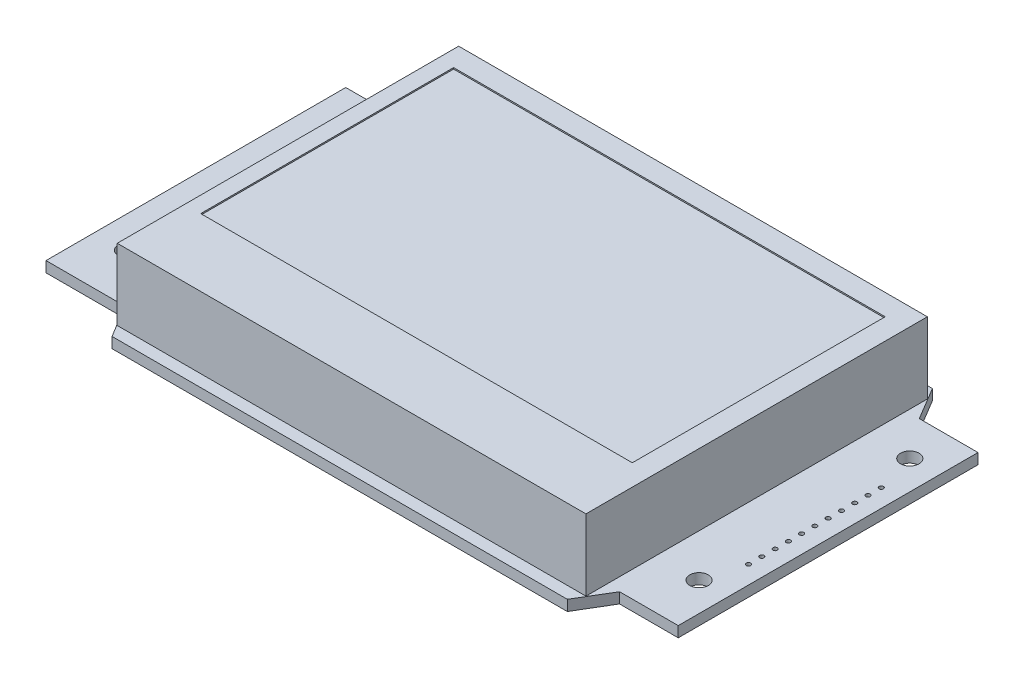
from build123d import *

# Parameters (mm, degrees)
BOSS_EXTRUDE1_DEPTH = 1.6
SKETCH2_R           = 1.397
CUT_EXTRUDE1_DEPTH  = 67.676798076
SKETCH3_W           = 70.612
SKETCH3_H           = 51.435
BOSS_EXTRUDE2_DEPTH = 10.7315
SKETCH4_W           = 65.024
SKETCH4_H           = 38.1
CUT_EXTRUDE2_DEPTH  = 0.2
SKETCH5_R           = 0.3302
CUT_EXTRUDE3_DEPTH  = 68.515927705
LPATTERN1_COUNT     = 11
LPATTERN1_PITCH     = 2


with BuildPart() as part:
    # Sketch1 → Boss-Extrude1 (new body)
    with BuildSketch(Plane(origin=(0, 0, 0), x_dir=(1, 0, 0), z_dir=(0, 1, 0))):
        Polygon((-60.059561589, 21.169974834), (-60.059561589, -23.991225166), (-48.223161589, -23.991225166), (-45.175161589, -28.915125166), (23.404838411, -28.915125166), (26.351238411, -23.991225166), (35.190438411, -23.991225166), (35.190438411, 21.169974834), (26.351238411, 21.169974834), (23.404838411, 26.084874834), (-45.175161589, 26.084874834), (-48.223161589, 21.169974834), align=None)
    extrude(amount=BOSS_EXTRUDE1_DEPTH)

    # Sketch2 → Cut-Extrude1 (cut, through all)
    with BuildSketch(Plane(origin=(0, 1.6, 0), x_dir=(1, 0, 0), z_dir=(0, 1, 0))):
        with Locations(Location((-55.271661589, 15.251774834, 0), (0, 0, 270))):
            Circle(SKETCH2_R)
        with Locations(Location((-55.271661589, -16.498225166, 0), (0, 0, 270))):
            Circle(SKETCH2_R)
        with Locations(Location((30.834338411, -16.498225166, 0), (0, 0, 270))):
            Circle(SKETCH2_R)
        with Locations(Location((30.834338411, 15.251774834, 0), (0, 0, 270))):
            Circle(SKETCH2_R)
    extrude(amount=-CUT_EXTRUDE1_DEPTH, mode=Mode.SUBTRACT)

    # Sketch3 → Boss-Extrude2 (add)
    with BuildSketch(Plane(origin=(0, 1.6, 0), x_dir=(1, 0, 0), z_dir=(0, 1, 0))):
        with Locations((-10.910561589, -1.382625166)):
            Rectangle(SKETCH3_W, SKETCH3_H)
    extrude(amount=BOSS_EXTRUDE2_DEPTH)

    # Sketch4 → Cut-Extrude2 (cut)
    with BuildSketch(Plane(origin=(0, 12.3315, 0), x_dir=(1, 0, 0), z_dir=(0, 1, 0))):
        with Locations((-11.291561589, 2.109874834)):
            Rectangle(SKETCH4_W, SKETCH4_H)
    extrude(amount=-CUT_EXTRUDE2_DEPTH, mode=Mode.SUBTRACT)

    # Sketch5 → Cut-Extrude3 (cut, through all)
    with BuildSketch(Plane(origin=(0, 1.6, 0), x_dir=(1, 0, 0), z_dir=(0, 1, 0))):
        with Locations(Location((32.490438411, 9.299974834, 0), (0, 0, 270))):
            Circle(SKETCH5_R)
    cut_extrude3 = extrude(amount=-CUT_EXTRUDE3_DEPTH, mode=Mode.SUBTRACT)

    # LPattern1: Cut-Extrude3 ×11
    with Locations(*[(0, 0, i * LPATTERN1_PITCH) for i in range(1, LPATTERN1_COUNT)]):
        add(cut_extrude3, mode=Mode.SUBTRACT)


solid = part.part
